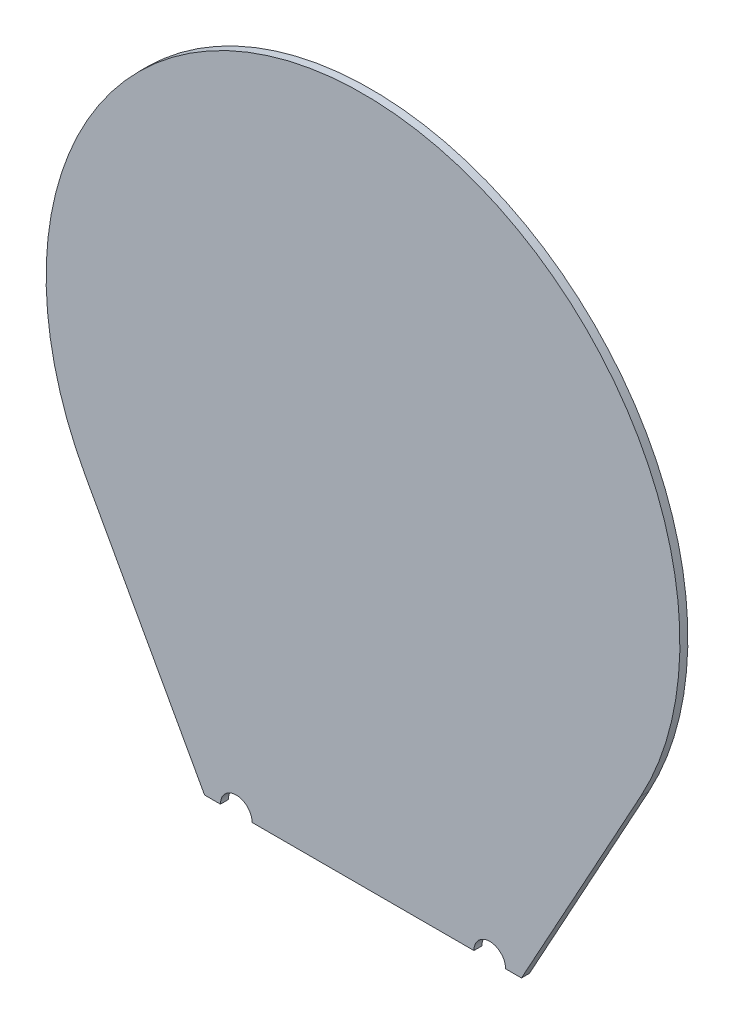
from build123d import *

# Parameters (mm, degrees)
BOSS_EXTRUDE1_DEPTH   = 0.75438
CORTE_EXTRUS_O1_DEPTH = 10


with BuildPart() as part:
    # Sketch1 → Boss-Extrude1 (new body)
    with BuildSketch(Plane.XY):
        with BuildLine():
            Line((-26.292884648, -14.44590658), (-15, -35))
            Line((-15, -35), (-7.5, -35))
            Line((-7.5, -35), (15, -35))
            Line((15, -35), (26.292884648, -14.44590658))
            ThreePointArc((26.292884648, -14.44590658), (0, 30), (-26.292884648, -14.44590658))
        make_face()
    extrude(amount=BOSS_EXTRUDE1_DEPTH)

    # Esboço1 → Corte-extrusão1 (cut)
    with BuildSketch(Plane.XY.offset(0.75438)):
        with BuildLine():
            ThreePointArc((13.5, -35), (12, -33.5), (10.5, -35))
            Line((10.5, -35), (13.5, -35))
        make_face()
        with BuildLine():
            Line((13.5, -35), (10.5, -35))
            ThreePointArc((10.5, -35), (12, -36.5), (13.5, -35))
        make_face()
        with BuildLine():
            ThreePointArc((-10.5, -35), (-12, -33.5), (-13.5, -35))
            Line((-13.5, -35), (-12, -35))
            Line((-12, -35), (-10.5, -35))
        make_face()
        with BuildLine():
            Line((-12, -35), (-13.5, -35))
            ThreePointArc((-13.5, -35), (-12, -36.5), (-10.5, -35))
            Line((-10.5, -35), (-12, -35))
        make_face()
    extrude(amount=-CORTE_EXTRUS_O1_DEPTH, mode=Mode.SUBTRACT)


solid = part.part
